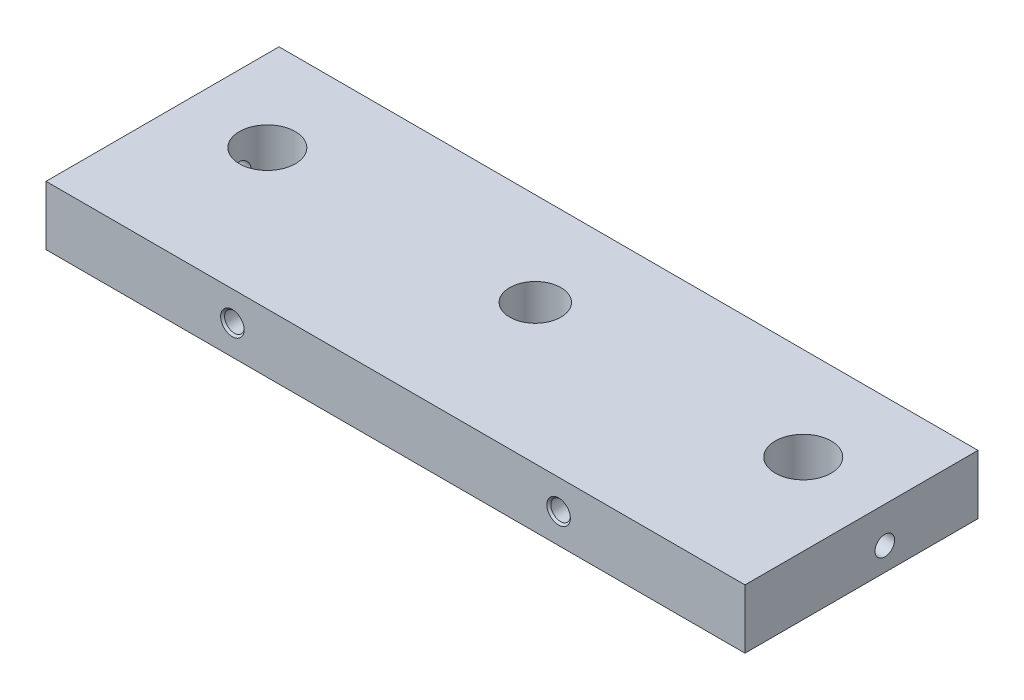
from build123d import *

# Parameters (mm, degrees)
ESBO_O1_W                       = 150
ESBO_O1_H                       = 40
ESBO_O1_R                       = 2.5
RESSALTO_EXTRUS_O1_DEPTH        = 12.7
ESBO_O2_R                       = 5.5
CORTE_EXTRUS_O1_DEPTH           = 8
ESBO_O3_R                       = 6
CORTE_EXTRUS_O3_DEPTH           = 79.652971972
ESBO_O7_W                       = 150
ESBO_O7_H                       = 10
RESSALTO_EXTRUS_O2_DEPTH        = 12.7
ESBO_O8_R                       = 2
CORTE_EXTRUS_O4_DEPTH           = 10
FURO_ROSCADO_DE_M54_D           = 4.2
FURO_ROSCADO_DE_M54_DEPTH       = 12.4
FURO_ROSCADO_DE_M54_CSINK_D     = 5.05
FURO_ROSCADO_DE_M54_CSINK_ANGLE = 90
FURO_ROSCADO_DE_M54_TIP         = 1.2618073
FURO_ROSCADO_DE_M55_D           = 4.2
FURO_ROSCADO_DE_M55_DEPTH       = 12.4
FURO_ROSCADO_DE_M55_CSINK_D     = 5.05
FURO_ROSCADO_DE_M55_CSINK_ANGLE = 90
FURO_ROSCADO_DE_M55_TIP         = 1.2618073


with BuildPart() as part:
    # Esboço1 → Ressalto-extrusão1 (new body)
    with BuildSketch(Plane(origin=(0, 0, 0), x_dir=(1, 0, 0), z_dir=(0, 1, 0))):
        Rectangle(ESBO_O1_W, ESBO_O1_H)
        with Locations(Location((0, 0, 0), (0, 0, 270))):
            Circle(ESBO_O1_R, mode=Mode.SUBTRACT)
    extrude(amount=RESSALTO_EXTRUS_O1_DEPTH)

    # Esboço2 → Corte-extrusão1 (cut)
    with BuildSketch(Plane(origin=(0, 12.7, 0), x_dir=(1, 0, 0), z_dir=(0, 1, 0))):
        with Locations(Location((0, 0, 0), (0, 0, 270))):
            Circle(ESBO_O2_R)
    extrude(amount=-CORTE_EXTRUS_O1_DEPTH, mode=Mode.SUBTRACT)

    # Esboço3 → Corte-extrusão3 (cut, through all)
    with BuildSketch(Plane(origin=(0, 12.7, 0), x_dir=(1, 0, 0), z_dir=(0, 1, 0))):
        with Locations(Location((-57.5, 0, 0), (0, 0, 270))):
            Circle(ESBO_O3_R)
        with Locations(Location((57.5, 0, 0), (0, 0, 270))):
            Circle(ESBO_O3_R)
    extrude(amount=-CORTE_EXTRUS_O3_DEPTH, mode=Mode.SUBTRACT)

    # Esboço6 → Furo roscado de M51 (revolve, cut)
    with BuildSketch(Plane(origin=(75, 5, 0), x_dir=(0, 0, -1), z_dir=(0, 1, 0))):
        Polygon((0, 0), (0, 13.2618073), (2.1, 12), (2.1, 0), align=None)
    furo_roscado_de_m51 = revolve(axis=Axis((81.35, 5, 0), (-1, 0, 0)), mode=Mode.SUBTRACT)

    # Espelhar1: Furo roscado de M51 across plane
    add(furo_roscado_de_m51.mirror(Plane(origin=(0, 0, 0), x_dir=(0, 0, 1), z_dir=(1, 0, 0))), mode=Mode.SUBTRACT)

    # Esboço7 → Ressalto-extrusão2 (add)
    with BuildSketch(Plane(origin=(0, 12.7, 0), x_dir=(1, 0, 0), z_dir=(0, 1, 0))):
        with Locations((0, -25)):
            Rectangle(ESBO_O7_W, ESBO_O7_H)
    extrude(amount=-RESSALTO_EXTRUS_O2_DEPTH)

    # Esboço8 → Corte-extrusão4 (cut)
    with BuildSketch(Plane.XY.offset(30)):
        with Locations((35, 6.35)):
            Circle(ESBO_O8_R)
        with Locations((-35, 6.35)):
            Circle(ESBO_O8_R)
    extrude(amount=-CORTE_EXTRUS_O4_DEPTH, mode=Mode.SUBTRACT)

    # Furo roscado de M54
    with Locations(Plane.XY.offset(30)):
        with Locations((-35, 6.35)):
            CounterSinkHole(FURO_ROSCADO_DE_M54_D / 2, FURO_ROSCADO_DE_M54_CSINK_D / 2, depth=FURO_ROSCADO_DE_M54_DEPTH, counter_sink_angle=FURO_ROSCADO_DE_M54_CSINK_ANGLE)
            with Locations((0, 0, -(FURO_ROSCADO_DE_M54_DEPTH + FURO_ROSCADO_DE_M54_TIP / 2))):  # 118° drill point
                Cone(0, FURO_ROSCADO_DE_M54_D / 2, FURO_ROSCADO_DE_M54_TIP, mode=Mode.SUBTRACT)

    # Furo roscado de M55
    with Locations(Plane.XY.offset(30)):
        with Locations((35, 6.35)):
            CounterSinkHole(FURO_ROSCADO_DE_M55_D / 2, FURO_ROSCADO_DE_M55_CSINK_D / 2, depth=FURO_ROSCADO_DE_M55_DEPTH, counter_sink_angle=FURO_ROSCADO_DE_M55_CSINK_ANGLE)
            with Locations((0, 0, -(FURO_ROSCADO_DE_M55_DEPTH + FURO_ROSCADO_DE_M55_TIP / 2))):  # 118° drill point
                Cone(0, FURO_ROSCADO_DE_M55_D / 2, FURO_ROSCADO_DE_M55_TIP, mode=Mode.SUBTRACT)


solid = part.part
